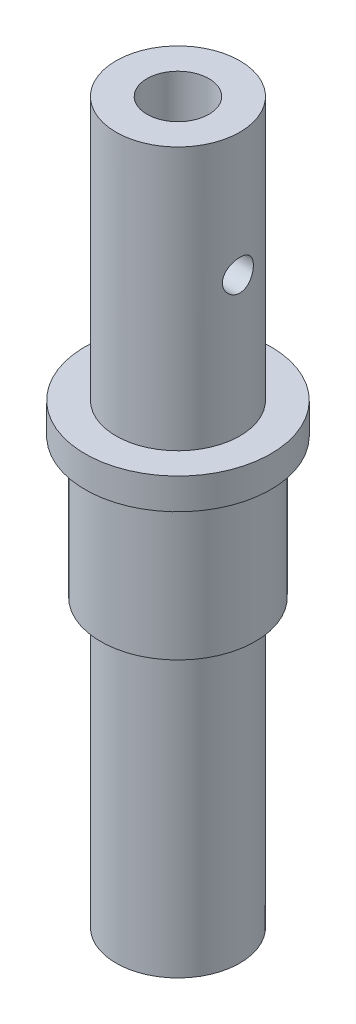
from build123d import *

# Parameters (mm, degrees)
SKETCH1_R                = 4
IMPELLER_SECTION_DEPTH   = 9
SKETCH2_R                = 2
IMPELLER_BOLT_BORE_DEPTH = 5
SEAL_START               = 8
SKETCH3_R                = 4
SEAL_SECTION_DEPTH       = 8
DOWEL_HOLE_DEPTH         = 10
DOWEL_HOLE_DEPTH_BACK    = 10
SKETCH5_R                = 1
SKETCH6_R                = 6
BEARING_STOP_DEPTH       = 2
SKETCH8_R                = 5
BEARING_SECTION_DEPTH    = 9
BOSS_EXTRUDE4_START      = 18.5
SKETCH9_R                = 4
BOSS_EXTRUDE4_DEPTH      = 18.5


with BuildPart() as part:
    # Sketch1 → impeller section (new body)
    with BuildSketch(Plane(origin=(0, 0, 0), x_dir=(1, 0, 0), z_dir=(0, 1, 0))):
        with Locations(Location((0, 0, 0), (0, 0, 270))):
            Circle(SKETCH1_R)
    extrude(amount=IMPELLER_SECTION_DEPTH)

    # Sketch2 → impeller bolt bore (cut)
    with BuildSketch(Plane(origin=(0, 9, 0), x_dir=(1, 0, 0), z_dir=(0, 1, 0))):
        with Locations(Location((0, 0, 0), (0, 0, 270))):
            Circle(SKETCH2_R)
    extrude(amount=-IMPELLER_BOLT_BORE_DEPTH, mode=Mode.SUBTRACT)

    # Sketch3 → seal section (add)
    with BuildSketch(Plane(origin=(0, 0, 0), x_dir=(-1, 0, 0), z_dir=(0, -1, 0)).offset(SEAL_START)):
        with Locations(Location((0, 0, 0), (0, 0, 90))):
            Circle(SKETCH3_R)
    extrude(amount=-SEAL_SECTION_DEPTH)

    # Sketch5 → dowel hole (cut, two sides: drawn at the far end of the back side and taken through both)
    with BuildSketch(Plane(origin=(0, 0, 0), x_dir=(0, 0, -1), z_dir=(1, 0, 0)).offset(-DOWEL_HOLE_DEPTH_BACK)):
        with Locations(Location((0, 1, 0), (0, 0, 180))):
            Circle(SKETCH5_R)
    extrude(amount=DOWEL_HOLE_DEPTH + DOWEL_HOLE_DEPTH_BACK, mode=Mode.SUBTRACT)

    # Sketch6 → bearing stop (add)
    with BuildSketch(Plane.XZ.offset(8)):
        with Locations(Location((0, 0, 0), (0, 0, 270))):
            Circle(SKETCH6_R)
    extrude(amount=BEARING_STOP_DEPTH)

    # Sketch8 → bearing section (add)
    with BuildSketch(Plane.XZ.offset(10)):
        with Locations(Location((0, 0, 0), (0, 0, 270))):
            Circle(SKETCH8_R)
    extrude(amount=BEARING_SECTION_DEPTH)

    # Sketch9 → Boss-Extrude4 (add)
    with BuildSketch(Plane(origin=(0, -19, 0), x_dir=(-1, 0, 0), z_dir=(0, -1, 0)).offset(BOSS_EXTRUDE4_START)):
        with Locations(Location((0, 0, 0), (0, 0, 90))):
            Circle(SKETCH9_R)
    extrude(amount=-BOSS_EXTRUDE4_DEPTH)


solid = part.part
